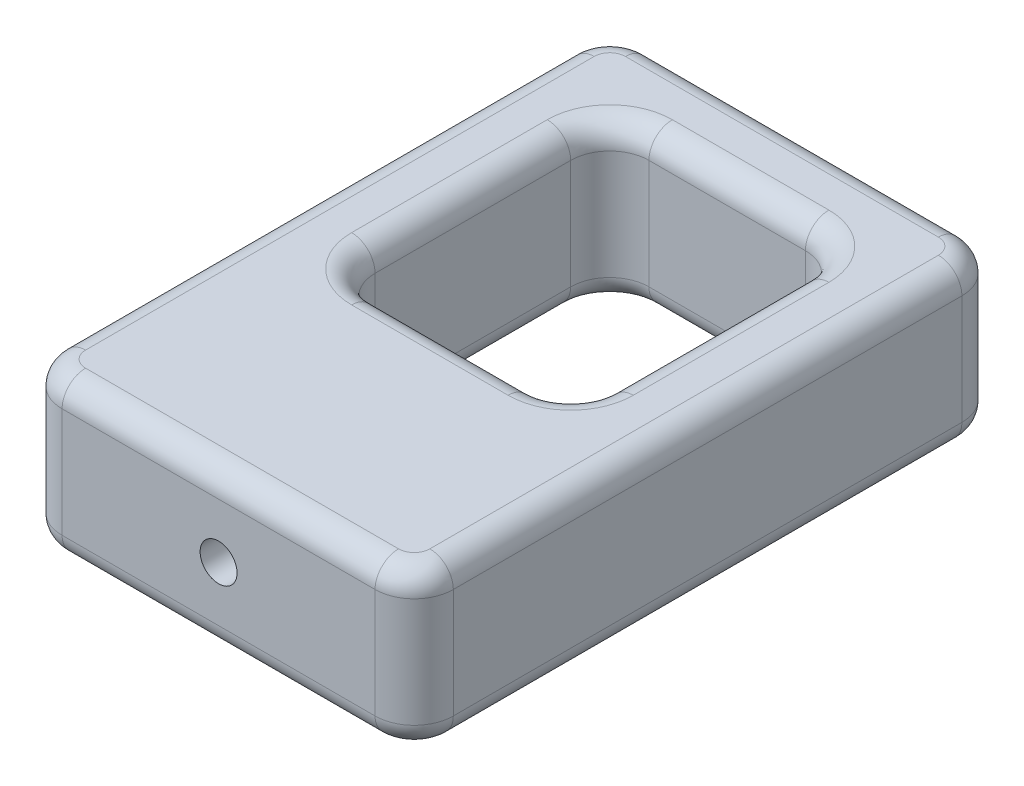
from build123d import *

# Parameters (mm, degrees)
SKETCH1_W           = 12.7
SKETCH1_H           = 19.05
BOSS_EXTRUDE1_DEPTH = 5.08
SKETCH2_W           = 7.62
SKETCH2_H           = 8.89
CUT_EXTRUDE1_DEPTH  = 13.524157656
SKETCH3_R           = 0.5999988
CUT_EXTRUDE3_DEPTH  = 7.62
FILLET1_R           = 1.27
FILLET2_R           = 1.27
FILLET3_R           = 0.762
FILLET4_R           = 0.762


with BuildPart() as part:
    # Sketch1 → Boss-Extrude1 (new body)
    with BuildSketch(Plane(origin=(0, 0, 0), x_dir=(1, 0, 0), z_dir=(0, 1, 0))):
        Rectangle(SKETCH1_W, SKETCH1_H)
    extrude(amount=BOSS_EXTRUDE1_DEPTH)

    # Sketch2 → Cut-Extrude1 (cut, through all)
    with BuildSketch(Plane.XZ):
        with Locations((0, -2.54)):
            Rectangle(SKETCH2_W, SKETCH2_H)
    extrude(amount=-CUT_EXTRUDE1_DEPTH, mode=Mode.SUBTRACT)

    # Sketch3 → Cut-Extrude3 (cut)
    with BuildSketch(Plane.XY.offset(9.525)):
        with Locations((0, 2.54)):
            Circle(SKETCH3_R)
    extrude(amount=-CUT_EXTRUDE3_DEPTH, mode=Mode.SUBTRACT)

    # Fillet1
    fillet1_edges = [part.edges().sort_by_distance(p)[0] for p in [
        (6.35, 2.54, 9.525),
        (-6.35, 2.54, 9.525),
        (-6.35, 2.54, -9.525),
        (6.35, 2.54, -9.525),
    ]]
    fillet(fillet1_edges, radius=FILLET1_R)

    # Fillet2
    fillet2_edges = [part.edges().sort_by_distance(p)[0] for p in [
        (3.81, 2.54, 1.905),
        (3.81, 2.54, -6.985),
        (-3.81, 2.54, -6.985),
        (-3.81, 2.54, 1.905),
    ]]
    fillet(fillet2_edges, radius=FILLET2_R)

    # Fillet3
    fillet3_edges = [part.edges().sort_by_distance(p)[0] for p in [
        (0, 5.08, -9.525),
        (6.35, 5.08, 0),
        (-6.35, 5.08, 0),
        (0, 5.08, 9.525),
        (5.978025612, 5.08, 9.153025612),
        (-5.978025612, 5.08, 9.153025612),
        (-5.978025612, 5.08, -9.153025612),
        (5.978025612, 5.08, -9.153025612),
    ]]
    fillet(fillet3_edges, radius=FILLET3_R)

    # Fillet4
    fillet4_edges = [part.edges().sort_by_distance(p)[0] for p in [
        (0, 0, -9.525),
        (6.35, 0, 0),
        (0, 0, 9.525),
        (-6.35, 0, 0),
        (5.978025612, 0, 9.153025612),
        (-5.978025612, 0, 9.153025612),
        (-5.978025612, 0, -9.153025612),
        (5.978025612, 0, -9.153025612),
        (0, 0, -6.985),
        (0, 5.08, -6.985),
        (-3.81, 0, -2.54),
        (-3.81, 5.08, -2.54),
        (3.81, 0, -2.54),
        (3.81, 5.08, -2.54),
        (0, 0, 1.905),
        (0, 5.08, 1.905),
        (-3.438025612, 0, -6.613025612),
        (-3.438025612, 5.08, -6.613025612),
        (3.438025612, 0, -6.613025612),
        (3.438025612, 5.08, -6.613025612),
        (-3.438025612, 0, 1.533025612),
        (-3.438025612, 5.08, 1.533025612),
        (3.438025612, 0, 1.533025612),
        (3.438025612, 5.08, 1.533025612),
    ]]
    fillet(fillet4_edges, radius=FILLET4_R)


solid = part.part
